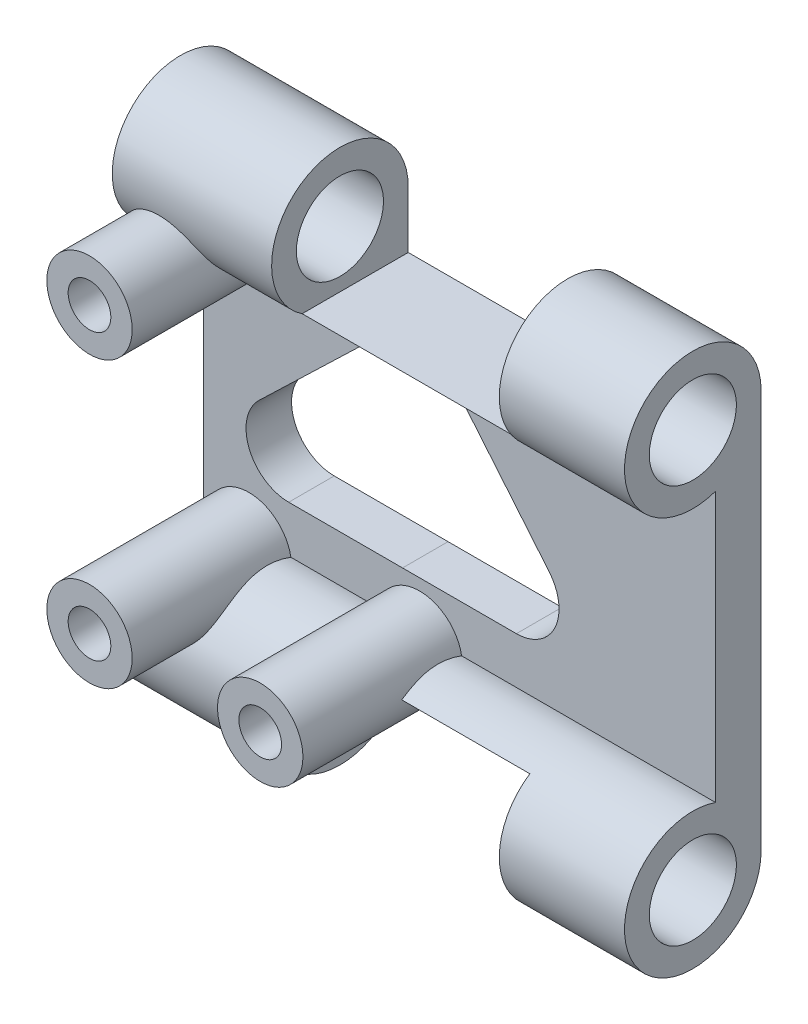
from build123d import *

# Parameters (mm, degrees)
ESBO_O2_R                  = 7.65
RESSALTO_EXTRUS_O1_DEPTH   = 90
CORTE_EXTRUS_O1_DEPTH      = 103.786185842
CORTE_EXTRUS_O1_DEPTH_BACK = 103.786185842
ESBO_O4_R                  = 1.75
CORTE_EXTRUS_O2_DEPTH      = 108.786185991
CORTE_EXTRUS_O2_DEPTH_BACK = 20
CORTE_EXTRUS_O2_START      = -5
ESBO_O5_W                  = 40
ESBO_O5_H                  = 25
RESSALTO_EXTRUS_O2_START   = -8
ESBO_O6_R                  = 7.5
ESBO_O6_R_2                = 3.75
RESSALTO_EXTRUS_O2_DEPTH   = 36
ESBO_O7_R                  = 7.65
CORTE_EXTRUS_O3_DEPTH      = 28
ESBO_O8_R                  = 4.5
CORTE_EXTRUS_O4_DEPTH      = 105.33120354


with BuildPart() as part:
    # Esboço2 → Ressalto-extrusão1 (new body)
    with BuildSketch(Plane(origin=(0, 0, 0), x_dir=(0, 0, -1), z_dir=(1, 0, 0))):
        with BuildLine():
            Line((12, 35), (12, -35))
            ThreePointArc((12, -35), (-9.797958971, -41.92820323), (4, -23.686291501))
            Line((4, -23.686291501), (4, 23.686291501))
            ThreePointArc((4, 23.686291501), (-9.797958971, 41.92820323), (12, 35))
        make_face()
        with Locations(Location((0, 35, 0), (0, 0, 180))):
            Circle(ESBO_O2_R, mode=Mode.SUBTRACT)
        with Locations(Location((0, -35, 0), (0, 0, 180))):
            Circle(ESBO_O2_R, mode=Mode.SUBTRACT)
    extrude(amount=RESSALTO_EXTRUS_O1_DEPTH)

    # Esboço4 → Corte-extrusão1 (cut, two sides: drawn at the far end of the back side and taken through both)
    with BuildSketch(Plane.XY.offset(-4).offset(-CORTE_EXTRUS_O1_DEPTH_BACK)):
        with Locations((8, 25)):
            Circle(ESBO_O4_R)
        with Locations((8, -25)):
            Circle(ESBO_O4_R)
        with Locations((38, -25)):
            Circle(ESBO_O4_R)
        with BuildLine():
            Line((9.800556125, -2.594837339), (29.720778576, 16.567227726))
            ThreePointArc((29.720778576, 16.567227726), (37.589266527, 19.483451958), (45.081385717, 15.703820171))
            Line((45.081385717, 15.703820171), (60.772418369, -3.211557021))
            ThreePointArc((60.772418369, -3.211557021), (61.788295077, -11.188894784), (54.99975362, -15.499999996))
            Line((54.99975362, -15.499999996), (35, -15.499342991))
            Line((35, -15.499342991), (15.00024638, -15.499999996))
            ThreePointArc((15.00024638, -15.499999996), (8.043440545, -10.802905733), (9.800556125, -2.594837339))
        make_face()
    extrude(amount=CORTE_EXTRUS_O1_DEPTH + CORTE_EXTRUS_O1_DEPTH_BACK, mode=Mode.SUBTRACT)

    # Esboço5 → Corte-extrusão2 (cut, two sides: drawn at the far end of the back side and taken through both)
    with BuildSketch(Plane.XY.offset(-4).offset(CORTE_EXTRUS_O2_START - CORTE_EXTRUS_O2_DEPTH_BACK)):
        with Locations((48, -37.5)):
            Rectangle(ESBO_O5_W, ESBO_O5_H)
        with Locations((48, 37.5)):
            Rectangle(ESBO_O5_W, ESBO_O5_H)
    extrude(amount=CORTE_EXTRUS_O2_DEPTH + CORTE_EXTRUS_O2_DEPTH_BACK, mode=Mode.SUBTRACT)

    # Esboço6 → Ressalto-extrusão2 (add)
    # profile 1 of 3: a face of its own
    with BuildSketch(Plane.XY.offset(-4).offset(RESSALTO_EXTRUS_O2_START)):
        with Locations((8, 25)):
            Circle(ESBO_O6_R)
        with Locations((8, 25)):
            Circle(ESBO_O6_R_2, mode=Mode.SUBTRACT)
    # profile 2 of 3: a face of its own
    with BuildSketch(Plane.XY.offset(-4).offset(RESSALTO_EXTRUS_O2_START)):
        with Locations((8, -25)):
            Circle(ESBO_O6_R)
        with Locations((8, -25)):
            Circle(ESBO_O6_R_2, mode=Mode.SUBTRACT)
    # profile 3 of 3: a face of its own
    with BuildSketch(Plane.XY.offset(-4).offset(RESSALTO_EXTRUS_O2_START)):
        with Locations((38, -25)):
            Circle(ESBO_O6_R)
        with Locations((38, -25)):
            Circle(ESBO_O6_R_2, mode=Mode.SUBTRACT)
    extrude(amount=RESSALTO_EXTRUS_O2_DEPTH)

    # Esboço7 → Corte-extrusão3 (cut)
    with BuildSketch(Plane.ZY):
        with Locations((0, 35)):
            Circle(ESBO_O7_R)
        with Locations((0, -35)):
            Circle(ESBO_O7_R)
    extrude(amount=-CORTE_EXTRUS_O3_DEPTH, mode=Mode.SUBTRACT)

    # Esboço8 → Corte-extrusão4 (cut, through all)
    with BuildSketch(Plane.ZY):
        with Locations((0, -35)):
            Circle(ESBO_O8_R)
    extrude(amount=-CORTE_EXTRUS_O4_DEPTH, mode=Mode.SUBTRACT)


solid = part.part
